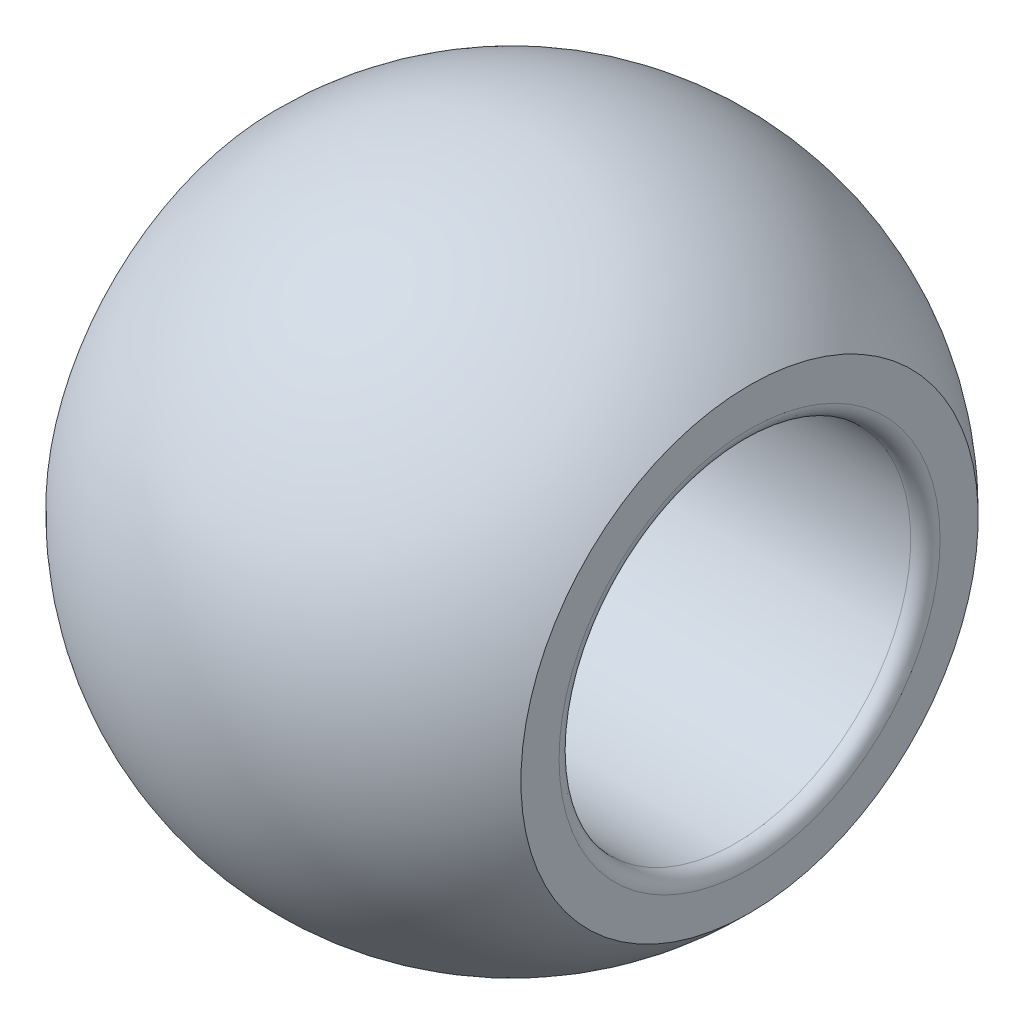
from build123d import *


with BuildPart() as part:
    # 스케치1 → 회전1 (revolve)
    with BuildSketch(Plane.XY, mode=Mode.PRIVATE) as revolve_1_sk:
        with BuildLine():
            Line((-8.1054771, 7.801521709), (-8.1054771, 6.5))
            ThreePointArc((-8.1054771, 6.5), (-7.959030491, 6.146446609), (-7.6054771, 6))
            Line((-7.6054771, 6), (7.6054771, 6))
            ThreePointArc((7.6054771, 6), (7.959030491, 6.146446609), (8.1054771, 6.5))
            Line((8.1054771, 6.5), (8.1054771, 7.801521709))
            ThreePointArc((8.1054771, 7.801521709), (0, 11.25), (-8.1054771, 7.801521709))
        make_face()
    revolve(revolve_1_sk.sketch.rotate(Axis((-8, 0, 0), (1, 0, 0)), 90), axis=Axis((-8, 0, 0), (1, 0, 0)))


solid = part.part
